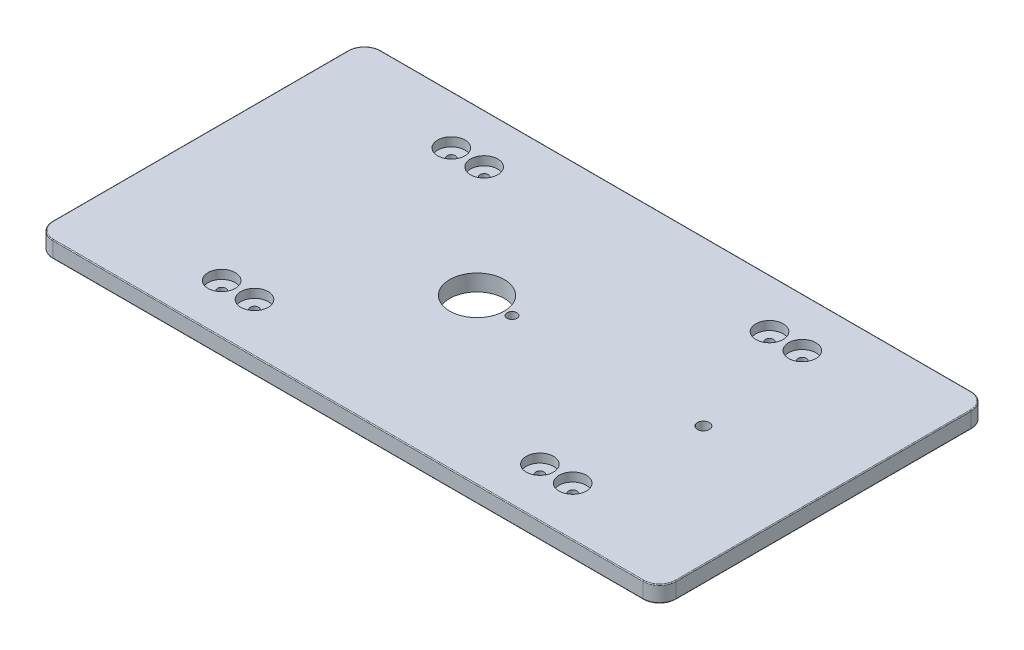
from build123d import *

# Parameters (mm, degrees)
SKETCH2_W           = 570
SKETCH2_H           = 300
SKETCH2_R           = 3.75
BOSS_EXTRUDE1_DEPTH = 15
FILLET1_R           = 15
FILLET2_R           = 0.75
SKETCH3_R           = 5.5
CUT_EXTRUDE1_DEPTH  = 323.41277895
CUT_EXTRUDE2_REACH  = 324.413
SKETCH4_R           = 4.5
SKETCH5_R           = 25
CUT_EXTRUDE3_DEPTH  = 323.41277895
SKETCH6_R           = 12.5
CUT_EXTRUDE4_DEPTH  = 8
SCALE1_SCALE        = 0.5


with BuildPart() as part:
    # Sketch2 → Boss-Extrude1 (new body)
    with BuildSketch(Plane(origin=(0, 0, 0), x_dir=(1, 0, 0), z_dir=(0, 1, 0))):
        Rectangle(SKETCH2_W, SKETCH2_H)
        with Locations(Location((-160.5, -105, 0), (0, 0, 270))):
            Circle(SKETCH2_R, mode=Mode.SUBTRACT)
        with Locations(Location((-130.5, -105, 0), (0, 0, 270))):
            Circle(SKETCH2_R, mode=Mode.SUBTRACT)
        with Locations(Location((-130.5, 105, 0), (0, 0, 90))):
            Circle(SKETCH2_R, mode=Mode.SUBTRACT)
        with Locations(Location((-160.5, 105, 0), (0, 0, 90))):
            Circle(SKETCH2_R, mode=Mode.SUBTRACT)
        with Locations(Location((160.5, 105, 0), (0, 0, 270))):
            Circle(SKETCH2_R, mode=Mode.SUBTRACT)
        with Locations(Location((130.5, 105, 0), (0, 0, 270))):
            Circle(SKETCH2_R, mode=Mode.SUBTRACT)
        with Locations(Location((160.5, -105, 0), (0, 0, 90))):
            Circle(SKETCH2_R, mode=Mode.SUBTRACT)
        with Locations(Location((130.5, -105, 0), (0, 0, 90))):
            Circle(SKETCH2_R, mode=Mode.SUBTRACT)
    extrude(amount=BOSS_EXTRUDE1_DEPTH)

    # Fillet1
    fillet1_edges = [part.edges().sort_by_distance(p)[0] for p in [
        (285, 7.5, 150),
        (-285, 7.5, 150),
        (-285, 7.5, -150),
        (285, 7.5, -150),
    ]]
    fillet(fillet1_edges, radius=FILLET1_R)

    # Fillet2
    fillet2_edges = [part.edges().sort_by_distance(p)[0] for p in [
        (-160.5, 0, 101.25),
        (-160.5, 15, 101.25),
        (-130.5, 0, 101.25),
        (-130.5, 15, 101.25),
        (-130.5, 0, -101.25),
        (-130.5, 15, -101.25),
        (-160.5, 0, -101.25),
        (-160.5, 15, -101.25),
        (160.5, 0, -108.75),
        (160.5, 15, -108.75),
        (130.5, 0, -108.75),
        (130.5, 15, -108.75),
        (160.5, 0, 108.75),
        (160.5, 15, 108.75),
        (130.5, 0, 108.75),
        (130.5, 15, 108.75),
        (0, 0, 150),
        (0, 15, 150),
        (285, 0, 0),
        (-285, 0, 0),
        (0, 0, -150),
        (280.606601718, 0, 145.606601718),
        (280.606601718, 0, -145.606601718),
        (-280.606601718, 0, -145.606601718),
        (-280.606601718, 0, 145.606601718),
        (-285, 15, 0),
        (285, 15, 0),
        (0, 15, -150),
        (280.606601718, 15, 145.606601718),
        (280.606601718, 15, -145.606601718),
        (-280.606601718, 15, -145.606601718),
        (-280.606601718, 15, 145.606601718),
    ]]
    fillet(fillet2_edges, radius=FILLET2_R)

    # Sketch3 → Cut-Extrude1 (cut, through all)
    with BuildSketch(Plane(origin=(0, 15, 0), x_dir=(1, 0, 0), z_dir=(0, 1, 0))):
        with Locations(Location((175, 0, 0), (0, 0, 270))):
            Circle(SKETCH3_R)
    extrude(amount=-CUT_EXTRUDE1_DEPTH, mode=Mode.SUBTRACT)

    # Sketch4 → Cut-Extrude2 (cut, up to next)
    with BuildSketch(Plane(origin=(0, 15, 0), x_dir=(1, 0, 0), z_dir=(0, 1, 0)), mode=Mode.PRIVATE) as cut_extrude2_sk1:
        with Locations(Location((0, 0, 0), (0, 0, 270))):
            Circle(SKETCH4_R)
    cut_extrude2_tool1 = extrude(cut_extrude2_sk1.sketch, amount=-CUT_EXTRUDE2_REACH, mode=Mode.PRIVATE) & part.part
    add(cut_extrude2_tool1.solids().sort_by_distance((0, 15, 0))[0], mode=Mode.SUBTRACT)

    # Sketch5 → Cut-Extrude3 (cut, through all)
    with BuildSketch(Plane(origin=(0, 15, 0), x_dir=(1, 0, 0), z_dir=(0, 1, 0))):
        with Locations(Location((-32, 0, 0), (0, 0, 270))):
            Circle(SKETCH5_R)
    extrude(amount=-CUT_EXTRUDE3_DEPTH, mode=Mode.SUBTRACT)

    # Sketch6 → Cut-Extrude4 (cut)
    with BuildSketch(Plane(origin=(0, 15, 0), x_dir=(1, 0, 0), z_dir=(0, 1, 0))):
        with Locations(Location((160.5, 105, 0), (0, 0, 270))):
            Circle(SKETCH6_R)
        with Locations(Location((130.5, 105, 0), (0, 0, 270))):
            Circle(SKETCH6_R)
        with Locations(Location((-130.5, 105, 0), (0, 0, 270))):
            Circle(SKETCH6_R)
        with Locations(Location((-160.5, 105, 0), (0, 0, 270))):
            Circle(SKETCH6_R)
        with Locations(Location((-160.5, -105, 0), (0, 0, 270))):
            Circle(SKETCH6_R)
        with Locations(Location((-130.5, -105, 0), (0, 0, 270))):
            Circle(SKETCH6_R)
        with Locations(Location((130.5, -105, 0), (0, 0, 270))):
            Circle(SKETCH6_R)
        with Locations(Location((160.5, -105, 0), (0, 0, 270))):
            Circle(SKETCH6_R)
    extrude(amount=-CUT_EXTRUDE4_DEPTH, mode=Mode.SUBTRACT)


with BuildPart() as part_1:
    # Scale1: scaled about (0.277656822, 7.459980919, 0)
    add(part.part.scale(SCALE1_SCALE).moved(Location((0.138828411, 3.72999046, 0))))


solid = part_1.part
